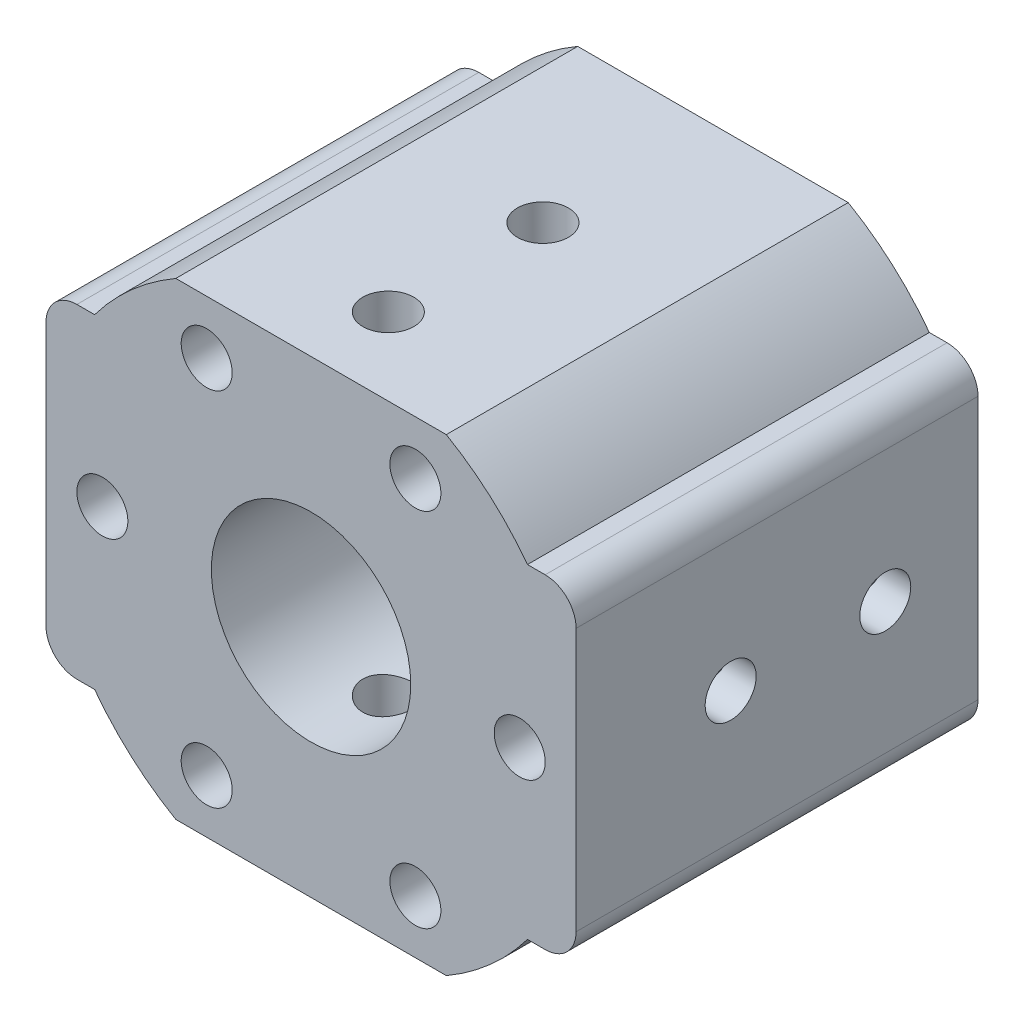
from build123d import *
from build123d.topology import SkipClean

# Parameters (mm, degrees)
EXTRUDE_1_DEPTH      = 30
SKETCH_3_R           = 6.45
CUT_EXTRUDE_1_DEPTH  = 38.893765978
SKETCH_4_R           = 1.65
CUT_EXTRUDE_2_DEPTH  = 47.097722286
CUT_EXTRUDE_START    = -14
SKETCH_7_W           = 30
SKETCH_7_H           = 7
CUT_EXTRUDE_4_DEPTH  = 30
CUT_EXTRUDE_START_2  = 14
SKETCH_7_2_W         = 30
SKETCH_7_2_H         = 7
CUT_EXTRUDE_5_DEPTH  = 30
SKETCH_10_W          = 30
SKETCH_10_H          = 7
EXTRUDE_2_DEPTH      = 3.14643
SKETCH_11_W          = 30
SKETCH_11_H          = 7
EXTRUDE_3_DEPTH      = 3.146428
SKETCH_12_R          = 1.65
CUT_EXTRUDE_6_DEPTH  = 49.270720898
SKETCH_14_W          = 2.981852414
SKETCH_14_H          = 30.826717304
SKETCH_14_W_2        = 3.229128589
SKETCH_14_H_2        = 31.791094385
CUT_EXTRUDE_7_DEPTH  = 47.097722467
SKETCH_17_R          = 1.65
CUT_EXTRUDE_9_DEPTH  = 49.017575073
CUT_EXTRUDE_10_DEPTH = 5
SKETCH_19_R          = 1.65
CUT_EXTRUDE_11_DEPTH = 34.892292803
FILLET_1_R           = 2
EXTRUDE_START        = 1
EXTRUDE_6_DEPTH      = 1


with BuildPart() as part:
    # 草图1 → 凸台-拉伸1 (new body)
    with BuildSketch(Plane.XY):
        with BuildLine():
            Line((8.75, 15.155444566), (-8.75, 15.155444566))
            ThreePointArc((-8.75, 15.155444566), (-17.5, 0), (-8.75, -15.155444566))
            Line((-8.75, -15.155444566), (8.75, -15.155444566))
            ThreePointArc((8.75, -15.155444566), (17.5, 0), (8.75, 15.155444566))
        make_face()
    extrude(amount=EXTRUDE_1_DEPTH)

    # 草图3 → 切除-拉伸1 (cut, through all)
    with BuildSketch(Plane.XY.offset(30)):
        Circle(SKETCH_3_R)
    extrude(amount=-CUT_EXTRUDE_1_DEPTH, mode=Mode.SUBTRACT)

    # 草图4 → 切除-拉伸2 (cut, through all)
    with BuildSketch(Plane(origin=(0, 15.155444566, 0), x_dir=(1, 0, 0), z_dir=(0, 1, 0))):
        with Locations(Location((0, -15, 0), (0, 0, 180))):
            Circle(SKETCH_4_R)
        with Locations(Location((0, -25, 0), (0, 0, 180))):
            Circle(SKETCH_4_R)
    extrude(amount=-CUT_EXTRUDE_2_DEPTH, mode=Mode.SUBTRACT)

    # 草图7 → 切除-拉伸4 (cut)
    with BuildSketch(Plane(origin=(0, 0, 0), x_dir=(0, 0, -1), z_dir=(1, 0, 0)).offset(CUT_EXTRUDE_START)):
        with Locations((-15, 7)):
            Rectangle(SKETCH_7_W, SKETCH_7_H)
        with Locations((-15, -7)):
            Rectangle(SKETCH_7_W, SKETCH_7_H)
    extrude(amount=-CUT_EXTRUDE_4_DEPTH, mode=Mode.SUBTRACT)

    # 草图7<2> → 切除-拉伸5 (cut)
    with BuildSketch(Plane(origin=(0, 0, 0), x_dir=(0, 0, -1), z_dir=(1, 0, 0)).offset(CUT_EXTRUDE_START_2)):
        with Locations((-15, 7)):
            Rectangle(SKETCH_7_2_W, SKETCH_7_2_H)
        with Locations((-15, -7)):
            Rectangle(SKETCH_7_2_W, SKETCH_7_2_H)
    extrude(amount=CUT_EXTRUDE_5_DEPTH, mode=Mode.SUBTRACT)

    # 草图10 → 凸台-拉伸2 (add)
    with BuildSketch(Plane.ZY.offset(14)):
        with Locations((15, -7)):
            Rectangle(SKETCH_10_W, SKETCH_10_H)
        with Locations((15, 7)):
            Rectangle(SKETCH_10_W, SKETCH_10_H)
    extrude(amount=EXTRUDE_2_DEPTH)

    # 草图11 → 凸台-拉伸3 (add)
    with BuildSketch(Plane(origin=(14, 0, 0), x_dir=(0, 0, -1), z_dir=(1, 0, 0))):
        with Locations((-15, -7)):
            Rectangle(SKETCH_11_W, SKETCH_11_H)
        with Locations((-15, 7)):
            Rectangle(SKETCH_11_W, SKETCH_11_H)
    extrude(amount=EXTRUDE_3_DEPTH)

    # 草图12 → 切除-拉伸6 (cut, through all)
    with BuildSketch(Plane.ZY.offset(17.146428199)):
        with Locations((20, 0)):
            Circle(SKETCH_12_R)
    extrude(amount=-CUT_EXTRUDE_6_DEPTH, mode=Mode.SUBTRACT)

    # 草图14 → 切除-拉伸7 (cut, through all)
    with SkipClean():  # the faces are left unmerged after this step: merging them gives an invalid solid
        with BuildSketch(Plane.XZ.offset(15.155444566)):
            with Locations((-18.637354406, 14.586641348)):
                Rectangle(SKETCH_14_W, SKETCH_14_H)
            with Locations((18.760992494, 14.104452808)):
                Rectangle(SKETCH_14_W_2, SKETCH_14_H_2)
        extrude(amount=-CUT_EXTRUDE_7_DEPTH, mode=Mode.SUBTRACT)

    # 草图17 → 切除-拉伸9 (cut, through all)
    with SkipClean():  # the faces are left unmerged after this step: merging them gives an invalid solid
        with BuildSketch(Plane(origin=(17.146428199, 0, 0), x_dir=(0, 0, -1), z_dir=(1, 0, 0))):
            with Locations((-10, 0)):
                Circle(SKETCH_17_R)
        extrude(amount=-CUT_EXTRUDE_9_DEPTH, mode=Mode.SUBTRACT)

    # 草图18 → 切除-拉伸10 (cut)
    with BuildSketch(Plane(origin=(0, 0, 0), x_dir=(-1, 0, 0), z_dir=(0, 0, -1))):
        with BuildLine():
            Line((-14, 10.5), (-17.146428199, 10.5))
            Line((-17.146428199, 10.5), (-17.146428199, -10.5))
            Line((-17.146428199, -10.5), (-14, -10.5))
            ThreePointArc((-14, -10.5), (-11.610724182, -13.093551236), (-8.75, -15.155444566))
            Line((-8.75, -15.155444566), (8.75, -15.155444566))
            ThreePointArc((8.75, -15.155444566), (11.610724182, -13.093551236), (14, -10.5))
            Line((14, -10.5), (17.146428199, -10.5))
            Line((17.146428199, -10.5), (17.146428199, 10.5))
            Line((17.146428199, 10.5), (14, 10.5))
            ThreePointArc((14, 10.5), (11.610724182, 13.093551236), (8.75, 15.155444566))
            Line((8.75, 15.155444566), (-8.75, 15.155444566))
            ThreePointArc((-8.75, 15.155444566), (-11.610724182, 13.093551236), (-14, 10.5))
        make_face()
    extrude(amount=-CUT_EXTRUDE_10_DEPTH, mode=Mode.SUBTRACT)

    # 草图19 → 切除-拉伸11 (cut, through all)
    with BuildSketch(Plane.XY.offset(30)):
        with Locations((13.5, 0)):
            Circle(SKETCH_19_R)
        with Locations((6.75, -11.691342951)):
            Circle(SKETCH_19_R)
        with Locations((-6.75, -11.691342951)):
            Circle(SKETCH_19_R)
        with Locations((-13.5, 0)):
            Circle(SKETCH_19_R)
        with Locations((-6.75, 11.691342951)):
            Circle(SKETCH_19_R)
        with Locations((6.75, 11.691342951)):
            Circle(SKETCH_19_R)
    extrude(amount=-CUT_EXTRUDE_11_DEPTH, mode=Mode.SUBTRACT)

    # 圆角1
    fillet_1_edges = [part.edges().sort_by_distance(p)[0] for p in [
        (-17.146428199, 10.5, 17.5),
        (17.146428, -10.5, 17.5),
        (17.146428, 10.5, 17.5),
        (-17.146428199, -10.5, 17.5),
    ]]
    fillet(fillet_1_edges, radius=FILLET_1_R)

    # 草图24 → 凸台-拉伸6 (add)
    with BuildSketch(Plane(origin=(0, 0, 5), x_dir=(-1, 0, 0), z_dir=(0, 0, -1)).offset(EXTRUDE_START)):
        with BuildLine():
            Line((-17.146428199, 8.5), (-17.146428199, -8.5))
            ThreePointArc((-17.146428199, -8.5), (-16.560641762, -9.914213562), (-15.146428199, -10.5))
            Line((-15.146428199, -10.5), (-14, -10.5))
            ThreePointArc((-14, -10.5), (-11.610724182, -13.093551236), (-8.75, -15.155444566))
            Line((-8.75, -15.155444566), (8.75, -15.155444566))
            ThreePointArc((8.75, -15.155444566), (11.610724182, -13.093551236), (14, -10.5))
            Line((14, -10.5), (15.146428199, -10.5))
            ThreePointArc((15.146428199, -10.5), (16.560641762, -9.914213562), (17.146428199, -8.5))
            Line((17.146428199, -8.5), (17.146428199, 8.5))
            ThreePointArc((17.146428199, 8.5), (16.560641762, 9.914213562), (15.146428199, 10.5))
            Line((15.146428199, 10.5), (14, 10.5))
            ThreePointArc((14, 10.5), (11.610724182, 13.093551236), (8.75, 15.155444566))
            Line((8.75, 15.155444566), (-8.75, 15.155444566))
            ThreePointArc((-8.75, 15.155444566), (-11.610724182, 13.093551236), (-14, 10.5))
            Line((-14, 10.5), (-15.146428199, 10.5))
            ThreePointArc((-15.146428199, 10.5), (-16.560641762, 9.914213562), (-17.146428199, 8.5))
        make_face()
    extrude(amount=-EXTRUDE_6_DEPTH)


solid = part.part
